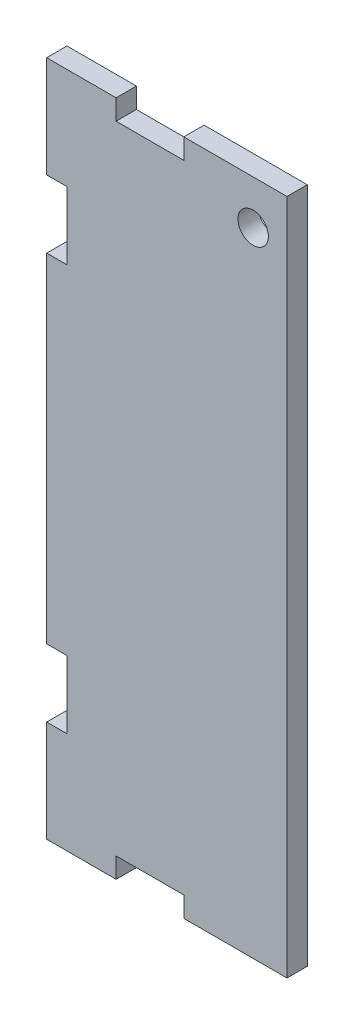
from build123d import *

# Parameters (mm, degrees)
BOSS_EXTRUDE1_DEPTH = 3
SKETCH2_W           = 5
SKETCH2_H           = 100
BOSS_EXTRUDE2_DEPTH = 3
SKETCH3_R           = 2.25
CUT_EXTRUDE1_DEPTH  = 3


with BuildPart() as part:
    # Sketch1 → Boss-Extrude1 (new body)
    with BuildSketch(Plane.XY):
        Polygon((-15.25, 50), (-15.25, 35), (-12.25, 35), (-12.25, 25), (-15.25, 25), (-15.25, -25), (-12.25, -25), (-12.25, -35), (-15.25, -35), (-15.25, -50), (-5, -50), (-5, -47), (5, -47), (5, -50), (15.25, -50), (15.25, 50), (5, 50), (5, 47), (-5, 47), (-5, 50), align=None)
    extrude(amount=BOSS_EXTRUDE1_DEPTH)

    # Sketch2 → Boss-Extrude2 (add)
    with BuildSketch(Plane.XY):
        with Locations((17.75, 0)):
            Rectangle(SKETCH2_W, SKETCH2_H)
    extrude(amount=BOSS_EXTRUDE2_DEPTH)

    # Sketch3 → Cut-Extrude1 (cut)
    with BuildSketch(Plane.XY.offset(3)):
        with Locations((15.25, 43.5)):
            Circle(SKETCH3_R)
    extrude(amount=-CUT_EXTRUDE1_DEPTH, mode=Mode.SUBTRACT)


solid = part.part
